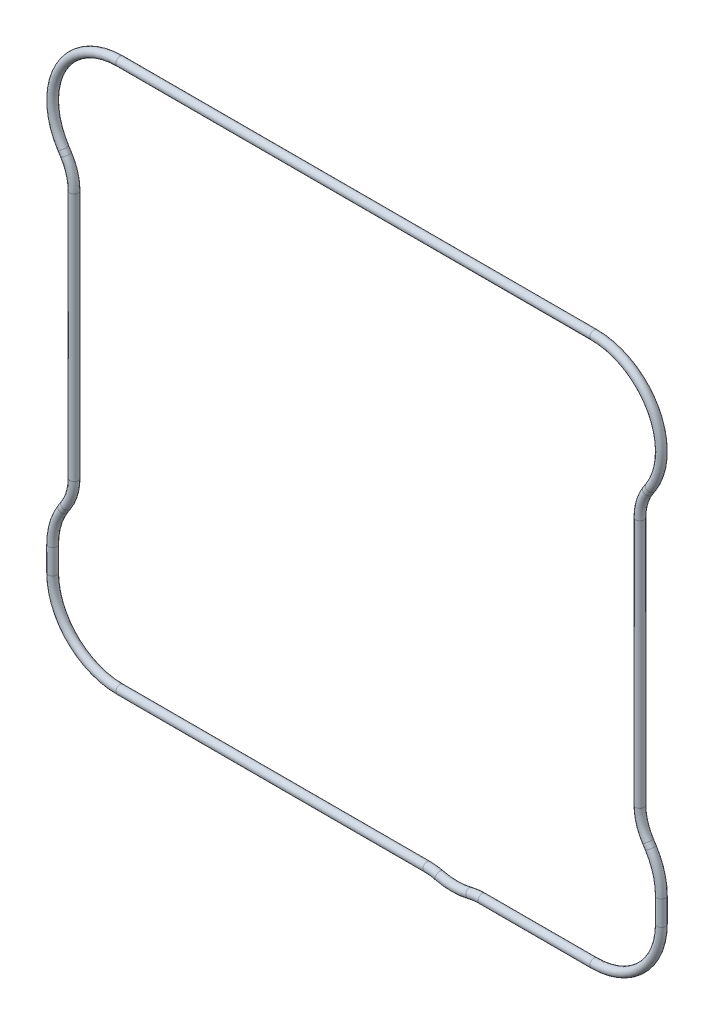
from build123d import *

# Parameters (mm, degrees)
SKETCH2_R = 1.5


with BuildPart() as part:
    # Sweep1: sweep along a path in Sketch1
    with BuildLine(Plane.XY) as sweep1_path:
        Line((105.338492591, -55.978163757), (104.331657727, -54.405612618))
        ThreePointArc((104.331657727, -54.405612618), (102.203838623, -49.730535717), (101.475, -44.645975517))
        Line((101.475, -44.645975517), (101.475, 44.645975517))
        ThreePointArc((101.475, 44.645975517), (102.203838623, 49.730535717), (104.331657727, 54.405612618))
        Line((104.331657727, 54.405612618), (105.338492591, 55.978163757))
        ThreePointArc((105.338492591, 55.978163757), (106.18607851, 80.591918623), (85, 93.15))
        Line((85, 93.15), (-85, 93.15))
        ThreePointArc((-85, 93.15), (-106.18607851, 80.591918623), (-105.338492591, 55.978163757))
        Line((-105.338492591, 55.978163757), (-104.331657727, 54.405612618))
        ThreePointArc((-104.331657727, 54.405612618), (-102.203838623, 49.730535717), (-101.475, 44.645975517))
        Line((-101.475, 44.645975517), (-101.475, -44.645975517))
        ThreePointArc((-101.475, -44.645975517), (-102.203838623, -49.730535717), (-104.331657727, -54.405612618))
        Line((-104.331657727, -54.405612618), (-105.338492591, -55.978163757))
        ThreePointArc((-105.338492591, -55.978163757), (-108.177544047, -62.215904484), (-109.15, -69))
        Line((-109.15, -69), (-109.15, -77.8))
        ThreePointArc((-109.15, -77.8), (-102.076628766, -94.876628766), (-85, -101.95))
        Line((-85, -101.95), (25.12275342, -101.95))
        ThreePointArc((25.12275342, -101.95), (27.305695555, -102.082118555), (29.456769495, -102.476545455))
        ThreePointArc((29.456769495, -102.476545455), (35, -103.15), (40.543230505, -102.476545455))
        ThreePointArc((40.543230505, -102.476545455), (42.694304445, -102.082118555), (44.87724658, -101.95))
        Line((44.87724658, -101.95), (85, -101.95))
        ThreePointArc((85, -101.95), (102.076628766, -94.876628766), (109.15, -77.8))
        Line((109.15, -77.8), (109.15, -69))
        ThreePointArc((109.15, -69), (108.177544047, -62.215904484), (105.338492591, -55.978163757))
    # Sketch2 → Sweep1 (sweep)
    with BuildSketch(Plane(origin=(0, 0, 0), x_dir=(1, 0, 0), z_dir=(0, 1, 0))):
        with Locations((101.475, 0)):
            Circle(SKETCH2_R)
    sweep(path=sweep1_path.line)


solid = part.part
